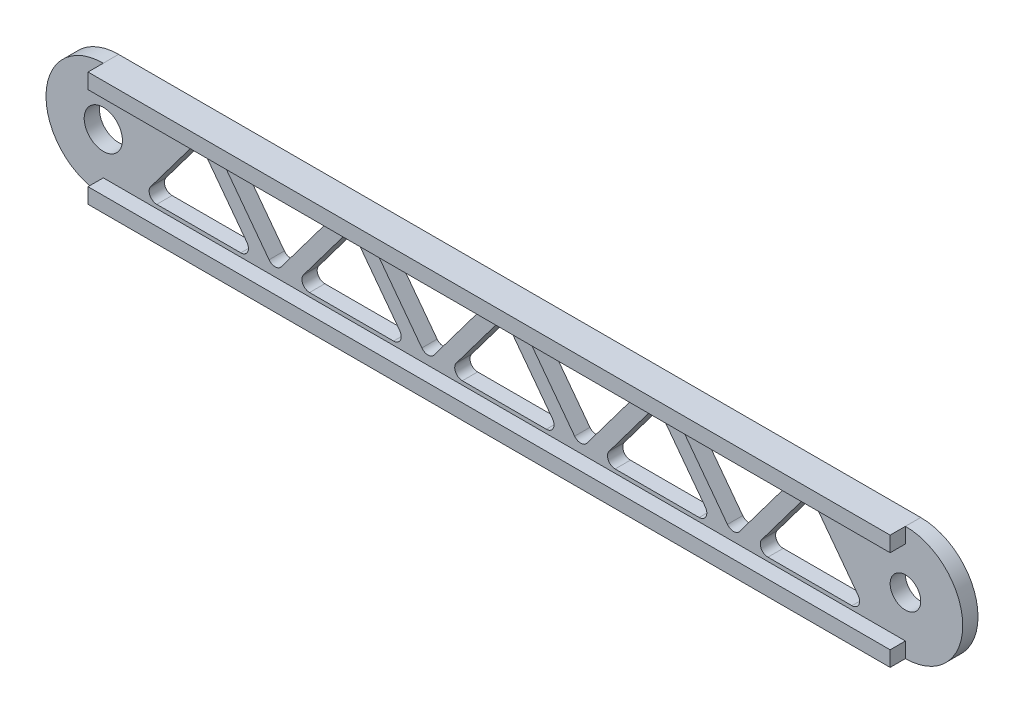
from build123d import *

# Parameters (mm, degrees)
SKETCH_1_W          = 420
SKETCH_1_H          = 60
EXTRUDE_1_DEPTH     = 8
SKETCH_2_R          = 30
EXTRUDE_2_DEPTH     = 8
SKETCH_3_W          = 420
SKETCH_3_H          = 8
EXTRUDE_3_DEPTH     = 8
SKETCH_4_R          = 10
CUT_EXTRUDE_1_DEPTH = 481
SKETCH_5_R          = 8
CUT_EXTRUDE_2_DEPTH = 481
CUT_EXTRUDE_3_DEPTH = 455.264240283


with BuildPart() as part:
    # 草图1 → 凸台-拉伸1 (new body)
    with BuildSketch(Plane.XY):
        with Locations((210, 30)):
            Rectangle(SKETCH_1_W, SKETCH_1_H)
    extrude(amount=EXTRUDE_1_DEPTH)

    # 草图2 → 凸台-拉伸2 (add)
    with BuildSketch(Plane.XY):
        with Locations((0, 30)):
            Circle(SKETCH_2_R)
        with Locations((420, 30)):
            Circle(SKETCH_2_R)
    extrude(amount=EXTRUDE_2_DEPTH)

    # 草图3 → 凸台-拉伸3 (add)
    with BuildSketch(Plane.XY.offset(8)):
        with Locations((210, 4)):
            Rectangle(SKETCH_3_W, SKETCH_3_H)
        with Locations((210, 56)):
            Rectangle(SKETCH_3_W, SKETCH_3_H)
    extrude(amount=EXTRUDE_3_DEPTH)

    # 草图4 → 切除-拉伸1 (cut, symmetric)
    with BuildSketch(Plane.XY.offset(8)):
        with Locations((0, 30)):
            Circle(SKETCH_4_R)
    extrude(amount=CUT_EXTRUDE_1_DEPTH, both=True, mode=Mode.SUBTRACT)

    # 草图5 → 切除-拉伸2 (cut, symmetric)
    with BuildSketch(Plane.XY.offset(8)):
        with Locations((420, 30)):
            Circle(SKETCH_5_R)
    extrude(amount=CUT_EXTRUDE_2_DEPTH, both=True, mode=Mode.SUBTRACT)

    # 草图6 → 切除-拉伸3 (cut, through all)
    with BuildSketch(Plane.XY):
        with BuildLine():
            Line((28, 10), (72, 10))
            ThreePointArc((72, 10), (75.577708764, 12.211145618), (75.2, 16.4))
            Line((75.2, 16.4), (53.2, 45.733333333))
            ThreePointArc((53.2, 45.733333333), (50, 47.333333333), (46.8, 45.733333333))
            Line((46.8, 45.733333333), (24.8, 16.4))
            ThreePointArc((24.8, 16.4), (24.422291236, 12.211145618), (28, 10))
        make_face()
        with BuildLine():
            Line((108, 10), (152, 10))
            ThreePointArc((152, 10), (155.577708764, 12.211145618), (155.2, 16.4))
            Line((155.2, 16.4), (133.2, 45.733333333))
            ThreePointArc((133.2, 45.733333333), (130, 47.333333333), (126.8, 45.733333333))
            Line((126.8, 45.733333333), (104.8, 16.4))
            ThreePointArc((104.8, 16.4), (104.422291236, 12.211145618), (108, 10))
        make_face()
        with BuildLine():
            Line((188, 10), (232, 10))
            ThreePointArc((232, 10), (235.577708764, 12.211145618), (235.2, 16.4))
            Line((235.2, 16.4), (213.2, 45.733333333))
            ThreePointArc((213.2, 45.733333333), (210, 47.333333333), (206.8, 45.733333333))
            Line((206.8, 45.733333333), (184.8, 16.4))
            ThreePointArc((184.8, 16.4), (184.422291236, 12.211145618), (188, 10))
        make_face()
        with BuildLine():
            Line((268, 10), (312, 10))
            ThreePointArc((312, 10), (315.577708764, 12.211145618), (315.2, 16.4))
            Line((315.2, 16.4), (293.2, 45.733333333))
            ThreePointArc((293.2, 45.733333333), (290, 47.333333333), (286.8, 45.733333333))
            Line((286.8, 45.733333333), (264.8, 16.4))
            ThreePointArc((264.8, 16.4), (264.422291236, 12.211145618), (268, 10))
        make_face()
        with BuildLine():
            Line((348, 10), (392, 10))
            ThreePointArc((392, 10), (395.577708764, 12.211145618), (395.2, 16.4))
            Line((395.2, 16.4), (373.2, 45.733333333))
            ThreePointArc((373.2, 45.733333333), (370, 47.333333333), (366.8, 45.733333333))
            Line((366.8, 45.733333333), (344.8, 16.4))
            ThreePointArc((344.8, 16.4), (344.422291236, 12.211145618), (348, 10))
        make_face()
        with BuildLine():
            Line((68, 50), (112, 50))
            ThreePointArc((112, 50), (115.577708764, 47.788854382), (115.2, 43.6))
            Line((115.2, 43.6), (93.2, 14.266666667))
            ThreePointArc((93.2, 14.266666667), (90, 12.666666667), (86.8, 14.266666667))
            Line((86.8, 14.266666667), (64.8, 43.6))
            ThreePointArc((64.8, 43.6), (64.422291236, 47.788854382), (68, 50))
        make_face()
        with BuildLine():
            Line((148, 50), (192, 50))
            ThreePointArc((192, 50), (195.577708764, 47.788854382), (195.2, 43.6))
            Line((195.2, 43.6), (173.2, 14.266666667))
            ThreePointArc((173.2, 14.266666667), (170, 12.666666667), (166.8, 14.266666667))
            Line((166.8, 14.266666667), (144.8, 43.6))
            ThreePointArc((144.8, 43.6), (144.422291236, 47.788854382), (148, 50))
        make_face()
        with BuildLine():
            Line((228, 50), (272, 50))
            ThreePointArc((272, 50), (275.577708764, 47.788854382), (275.2, 43.6))
            Line((275.2, 43.6), (253.2, 14.266666667))
            ThreePointArc((253.2, 14.266666667), (250, 12.666666667), (246.8, 14.266666667))
            Line((246.8, 14.266666667), (224.8, 43.6))
            ThreePointArc((224.8, 43.6), (224.422291236, 47.788854382), (228, 50))
        make_face()
        with BuildLine():
            Line((308, 50), (352, 50))
            ThreePointArc((352, 50), (355.577708764, 47.788854382), (355.2, 43.6))
            Line((355.2, 43.6), (333.2, 14.266666667))
            ThreePointArc((333.2, 14.266666667), (330, 12.666666667), (326.8, 14.266666667))
            Line((326.8, 14.266666667), (304.8, 43.6))
            ThreePointArc((304.8, 43.6), (304.422291236, 47.788854382), (308, 50))
        make_face()
    extrude(amount=CUT_EXTRUDE_3_DEPTH, mode=Mode.SUBTRACT)


solid = part.part
